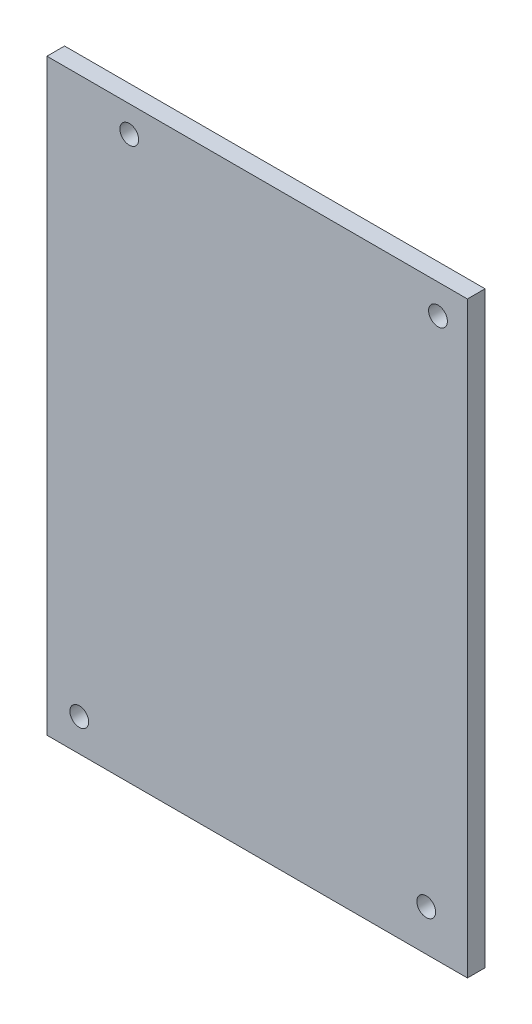
from build123d import *

# Parameters (mm, degrees)
SKETCH1_W           = 71.5
SKETCH1_H           = 100
SKETCH1_R           = 1.6
BOSS_EXTRUDE1_DEPTH = 3


with BuildPart() as part:
    # Sketch1 → Boss-Extrude1 (new body)
    with BuildSketch(Plane.XY):
        with Locations((35.75, 50)):
            Rectangle(SKETCH1_W, SKETCH1_H)
        with Locations((66.5, 95)):
            Circle(SKETCH1_R, mode=Mode.SUBTRACT)
        with Locations((64.5, 7)):
            Circle(SKETCH1_R, mode=Mode.SUBTRACT)
        with Locations((5.5, 5.5)):
            Circle(SKETCH1_R, mode=Mode.SUBTRACT)
        with Locations((14, 95.5)):
            Circle(SKETCH1_R, mode=Mode.SUBTRACT)
    extrude(amount=BOSS_EXTRUDE1_DEPTH)


solid = part.part
